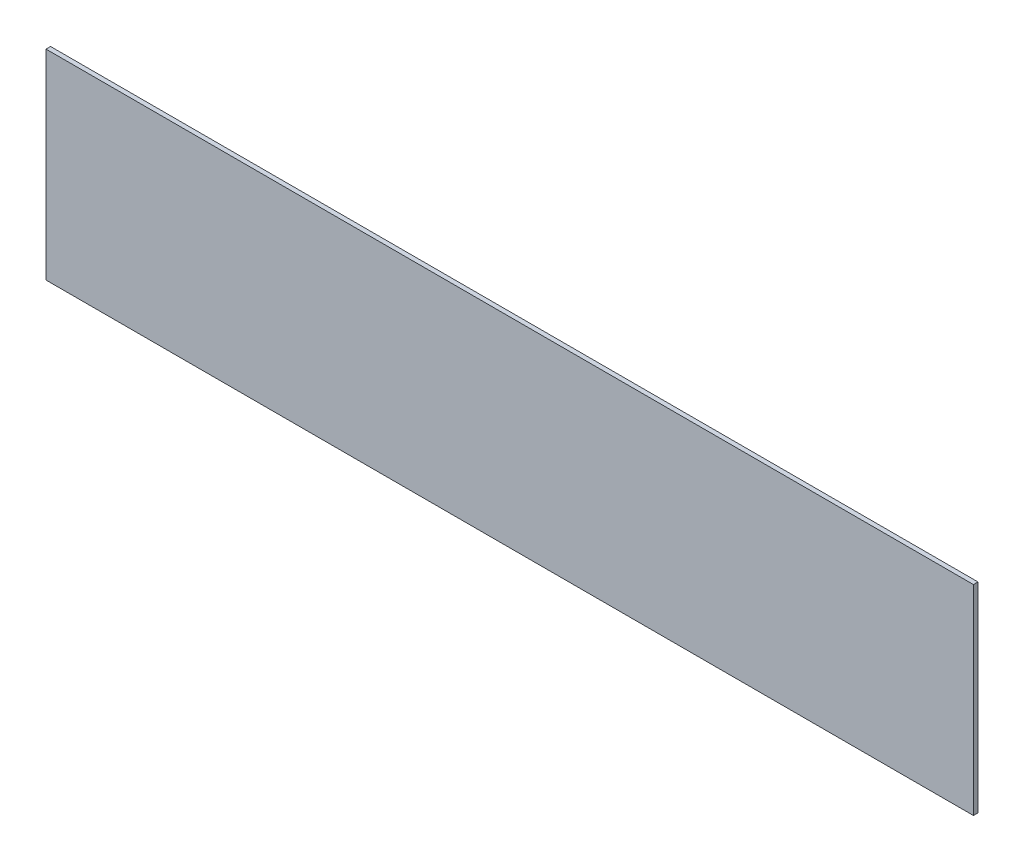
from build123d import *

# Parameters (mm, degrees)
SKETCH1_W           = 2040
SKETCH1_H           = 440
BOSS_EXTRUDE1_DEPTH = 10


with BuildPart() as part:
    # Sketch1 → Boss-Extrude1 (new body)
    with BuildSketch(Plane.XY):
        Rectangle(SKETCH1_W, SKETCH1_H)
    extrude(amount=BOSS_EXTRUDE1_DEPTH)


solid = part.part
